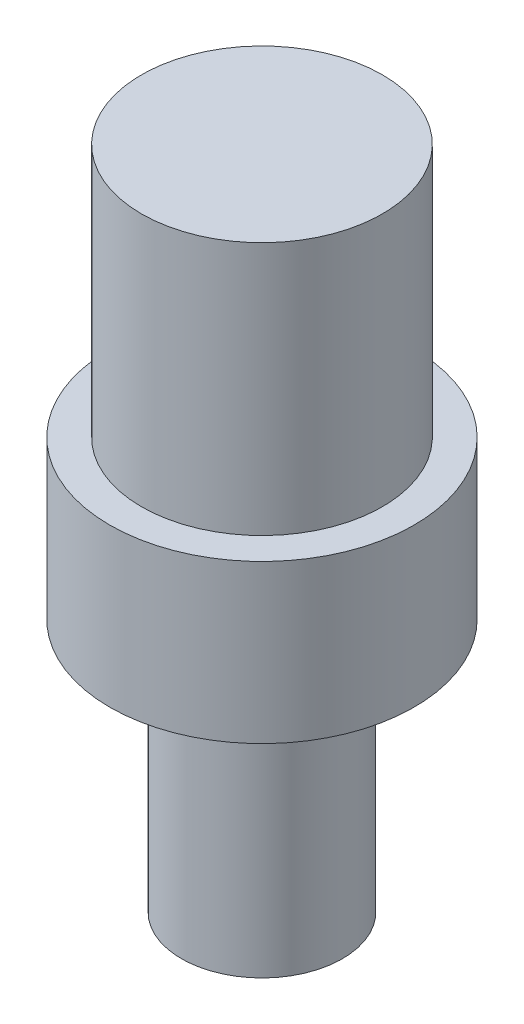
from build123d import *

# Parameters (mm, degrees)
SKETCH1_R           = 6
BOSS_EXTRUDE1_DEPTH = 3.11
SKETCH2_R           = 4.75
BOSS_EXTRUDE2_DEPTH = 10
SKETCH3_R           = 3.175
BOSS_EXTRUDE3_DEPTH = 10


with BuildPart() as part:
    # Sketch1 → Boss-Extrude1 (new, symmetric)
    with BuildSketch(Plane(origin=(0, 0, 0), x_dir=(1, 0, 0), z_dir=(0, 1, 0))):
        with Locations(Location((0, 0, 0), (0, 0, 270))):
            Circle(SKETCH1_R)
    extrude(amount=BOSS_EXTRUDE1_DEPTH, both=True)

    # Sketch2 → Boss-Extrude2 (add)
    with BuildSketch(Plane(origin=(0, 3.11, 0), x_dir=(1, 0, 0), z_dir=(0, 1, 0))):
        with Locations(Location((0, 0, 0), (0, 0, 270))):
            Circle(SKETCH2_R)
    extrude(amount=BOSS_EXTRUDE2_DEPTH)

    # Sketch3 → Boss-Extrude3 (add)
    with BuildSketch(Plane.XZ.offset(3.11)):
        with Locations(Location((0, 0, 0), (0, 0, 270))):
            Circle(SKETCH3_R)
    extrude(amount=BOSS_EXTRUDE3_DEPTH)


solid = part.part
